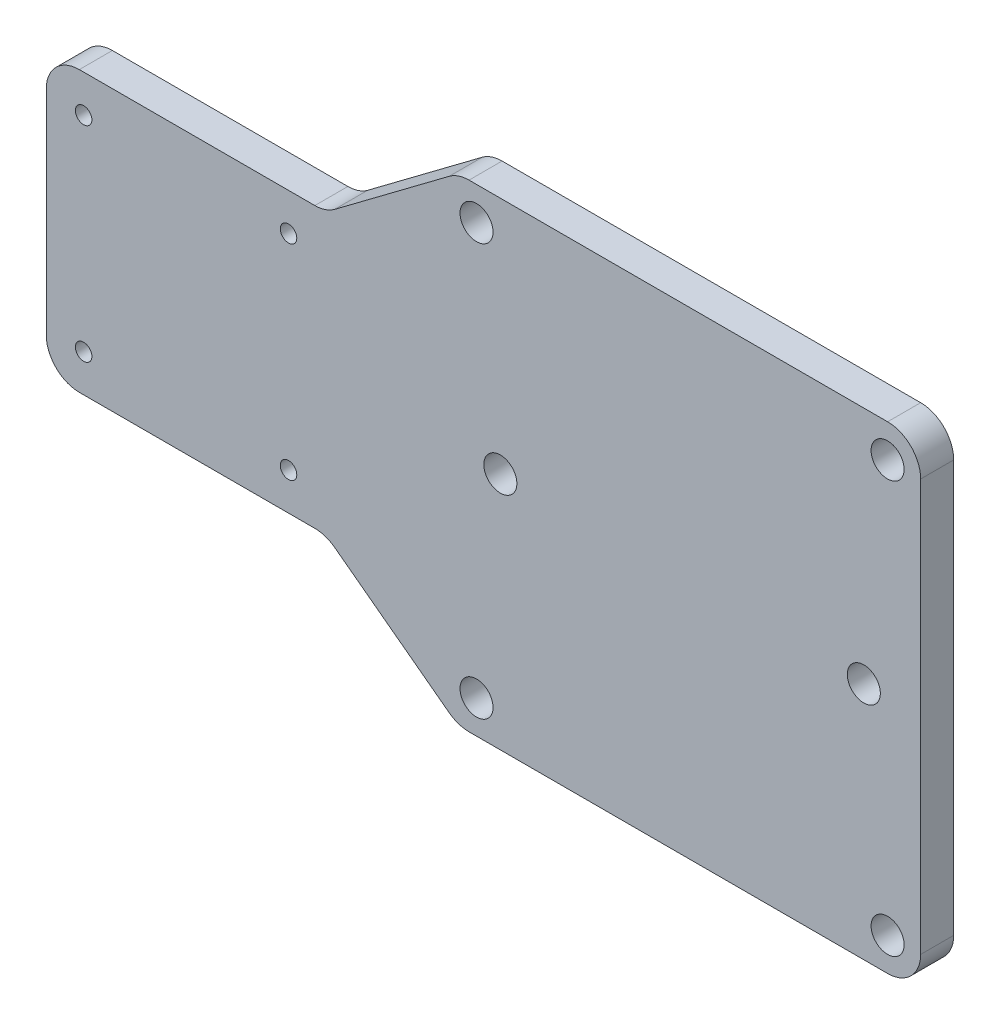
from build123d import *

# Parameters (mm, degrees)
BOSS_EXTRUDE1_DEPTH = 5
FILLET2_R           = 5
FILLET3_R           = 5
FILLET4_R           = 5
FILLET5_R           = 5
FILLET6_R           = 5
FILLET7_R           = 5
FILLET8_R           = 5
FILLET9_R           = 5
SKETCH2_R           = 1.25
SKETCH2_R_2         = 2.5
CUT_EXTRUDE1_DEPTH  = 10


with BuildPart() as part:
    # Sketch1 → Boss-Extrude1 (new body)
    with BuildSketch(Plane.XY):
        Polygon((21.15, 21.15), (41.15, 36.15), (111.15, 36.15), (111.15, -36.15), (41.15, -36.15), (21.15, -21.15), (-21.15, -21.15), (-21.15, 21.15), align=None)
    extrude(amount=BOSS_EXTRUDE1_DEPTH)

    # Fillet2
    fillet2_edges = [part.edges().sort_by_distance(p)[0] for p in [
        (-21.15, -21.15, 2.5),
    ]]
    fillet(fillet2_edges, radius=FILLET2_R)

    # Fillet3
    fillet3_edges = [part.edges().sort_by_distance(p)[0] for p in [
        (-21.15, 21.15, 2.5),
    ]]
    fillet(fillet3_edges, radius=FILLET3_R)

    # Fillet4
    fillet4_edges = [part.edges().sort_by_distance(p)[0] for p in [
        (21.15, 21.15, 2.5),
    ]]
    fillet(fillet4_edges, radius=FILLET4_R)

    # Fillet5
    fillet5_edges = [part.edges().sort_by_distance(p)[0] for p in [
        (21.15, -21.15, 2.5),
    ]]
    fillet(fillet5_edges, radius=FILLET5_R)

    # Fillet6
    fillet6_edges = [part.edges().sort_by_distance(p)[0] for p in [
        (41.15, -36.15, 2.5),
    ]]
    fillet(fillet6_edges, radius=FILLET6_R)

    # Fillet7
    fillet7_edges = [part.edges().sort_by_distance(p)[0] for p in [
        (41.15, 36.15, 2.5),
    ]]
    fillet(fillet7_edges, radius=FILLET7_R)

    # Fillet8
    fillet8_edges = [part.edges().sort_by_distance(p)[0] for p in [
        (111.15, 36.15, 2.5),
    ]]
    fillet(fillet8_edges, radius=FILLET8_R)

    # Fillet9
    fillet9_edges = [part.edges().sort_by_distance(p)[0] for p in [
        (111.15, -36.15, 2.5),
    ]]
    fillet(fillet9_edges, radius=FILLET9_R)

    # Sketch2 → Cut-Extrude1 (cut)
    with BuildSketch(Plane.XY.offset(5)):
        with Locations((-15.5, -15.5)):
            Circle(SKETCH2_R)
        with Locations((-15.5, 15.5)):
            Circle(SKETCH2_R)
        with Locations((15.5, 15.5)):
            Circle(SKETCH2_R)
        with Locations((15.5, -15.5)):
            Circle(SKETCH2_R)
        with Locations((106.15, 31.15)):
            Circle(SKETCH2_R_2)
        with Locations((106.15, -31.15)):
            Circle(SKETCH2_R_2)
        with Locations((43.95, -31.15)):
            Circle(SKETCH2_R_2)
        with Locations((43.95, 31.15)):
            Circle(SKETCH2_R_2)
        with Locations((102.55, 0)):
            Circle(SKETCH2_R_2)
        with Locations((47.55, 0)):
            Circle(SKETCH2_R_2)
    extrude(amount=-CUT_EXTRUDE1_DEPTH, mode=Mode.SUBTRACT)


solid = part.part
